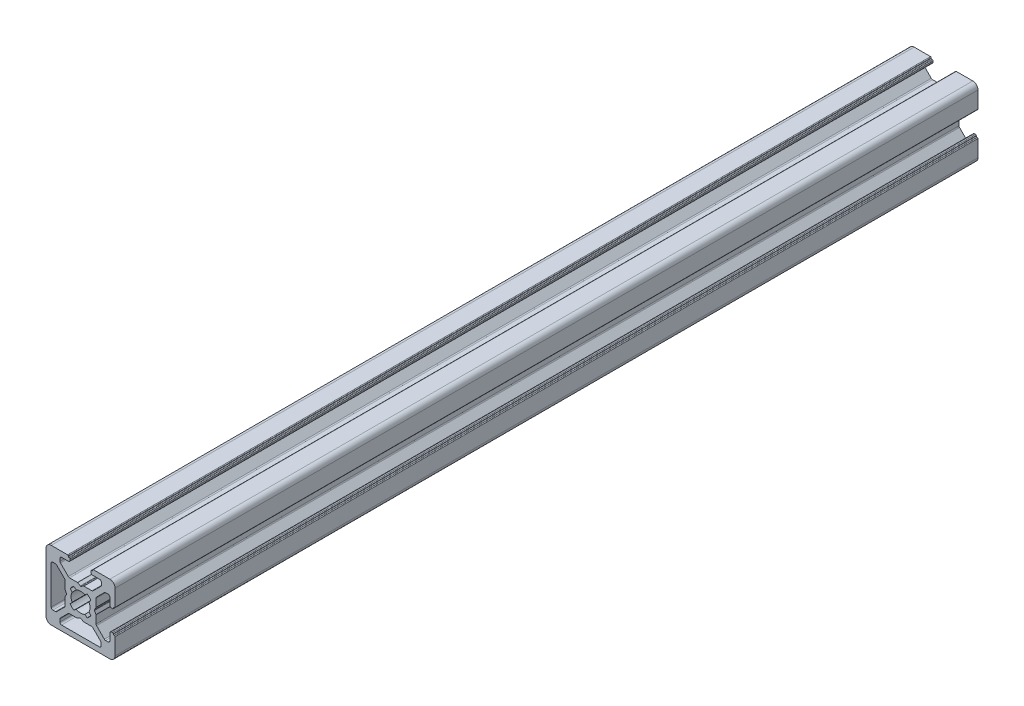
from build123d import *

# Parameters (mm, degrees)
EXTRUDE1_DEPTH = 250


with BuildPart() as part:
    # Sketch1 → Extrude1 (new body)
    with BuildSketch(Plane.XY):
        with BuildLine():
            Line((-8.5, -10), (8.5, -10))
            ThreePointArc((8.5, -10), (9.560660172, -9.560660172), (10, -8.5))
            Line((10, -8.5), (10, -3.7))
            ThreePointArc((10, -3.7), (9.941421356, -3.558578644), (9.8, -3.5))
            Line((9.8, -3.5), (9.7, -3.5))
            ThreePointArc((9.7, -3.5), (9.558578644, -3.441421356), (9.5, -3.3))
            Line((9.5, -3.3), (9.5, -3.2))
            ThreePointArc((9.5, -3.2), (9.441421356, -3.058578644), (9.3, -3))
            Line((9.3, -3), (9, -3))
            ThreePointArc((9, -3), (8.646446609, -3.146446609), (8.5, -3.5))
            Line((8.5, -3.5), (8.5, -5.500000208))
            ThreePointArc((8.5, -5.500000208), (8.353553391, -5.853553598), (8, -6.000000208))
            Line((8, -6.000000208), (7.267767022, -6.000000208))
            ThreePointArc((7.267767022, -6.000000208), (7.076425294, -5.961939969), (6.914213614, -5.853553581))
            Line((6.914213614, -5.853553581), (4.646446828, -3.585786575))
            ThreePointArc((4.646446828, -3.585786575), (4.538060465, -3.423574906), (4.500000236, -3.232233201))
            Line((4.500000236, -3.232233201), (4.500000236, -0.953589838))
            ThreePointArc((4.500000236, -0.953589838), (4.493185401, -0.901826029), (4.473205317, -0.853589838))
            Line((4.473205317, -0.853589838), (4.038120021, -0.1))
            ThreePointArc((4.038120021, -0.1), (4.011325101, 0), (4.038120021, 0.1))
            Line((4.038120021, 0.1), (4.473205317, 0.853589838))
            ThreePointArc((4.473205317, 0.853589838), (4.493185401, 0.901826029), (4.500000236, 0.953589838))
            Line((4.500000236, 0.953589838), (4.500000236, 3.232233262))
            ThreePointArc((4.500000236, 3.232233262), (4.538060467, 3.423574973), (4.646446837, 3.585786644))
            Line((4.646446837, 3.585786644), (6.914213678, 5.853553596))
            ThreePointArc((6.914213678, 5.853553596), (7.076425355, 5.961939978), (7.267767077, 6.000000214))
            Line((7.267767077, 6.000000214), (8.000000112, 6.000000214))
            ThreePointArc((8.000000112, 6.000000214), (8.353553502, 5.853553604), (8.500000112, 5.500000214))
            Line((8.500000112, 5.500000214), (8.500000112, 3.5))
            ThreePointArc((8.500000112, 3.5), (8.646446721, 3.146446609), (9.000000112, 3))
            Line((9.000000112, 3), (9.300000112, 3))
            ThreePointArc((9.300000112, 3), (9.441421468, 3.058578644), (9.500000112, 3.2))
            Line((9.500000112, 3.2), (9.500000112, 3.3))
            ThreePointArc((9.500000112, 3.3), (9.558578756, 3.441421356), (9.700000112, 3.5))
            Line((9.700000112, 3.5), (9.8, 3.5))
            ThreePointArc((9.8, 3.5), (9.941421356, 3.558578644), (10, 3.7))
            Line((10, 3.7), (10, 8.5))
            ThreePointArc((10, 8.5), (9.560660172, 9.560660172), (8.5, 10))
            Line((8.5, 10), (3.7, 10))
            ThreePointArc((3.7, 10), (3.558578644, 9.941421356), (3.5, 9.8))
            Line((3.5, 9.8), (3.5, 9.7))
            ThreePointArc((3.5, 9.7), (3.441421356, 9.558578644), (3.3, 9.5))
            Line((3.3, 9.5), (3.2, 9.5))
            ThreePointArc((3.2, 9.5), (3.058578644, 9.441421356), (3, 9.3))
            Line((3, 9.3), (3, 9.000000069))
            ThreePointArc((3, 9.000000069), (3.146446609, 8.646446678), (3.5, 8.500000069))
            Line((3.5, 8.500000069), (5.550000287, 8.500000069))
            ThreePointArc((5.550000287, 8.500000069), (5.903553677, 8.353553459), (6.050000287, 8.000000069))
            Line((6.050000287, 8.000000069), (6.050000287, 7.267766898))
            ThreePointArc((6.050000287, 7.267766898), (6.011940051, 7.076425176), (5.903553669, 6.914213499))
            Line((5.903553669, 6.914213499), (3.635786717, 4.646446658))
            ThreePointArc((3.635786717, 4.646446658), (3.473575046, 4.538060288), (3.282233335, 4.500000057))
            Line((3.282233335, 4.500000057), (1.003589985, 4.500000057))
            ThreePointArc((1.003589985, 4.500000057), (0.951826176, 4.493185222), (0.903589985, 4.473205138))
            Line((0.903589985, 4.473205138), (0.150000146, 4.038119841))
            ThreePointArc((0.150000146, 4.038119841), (0.050000146, 4.011324922), (-0.049999854, 4.038119841))
            Line((-0.049999854, 4.038119841), (-0.803589692, 4.473205138))
            ThreePointArc((-0.803589692, 4.473205138), (-0.851825883, 4.493185222), (-0.903589692, 4.500000057))
            Line((-0.903589692, 4.500000057), (-3.182233104, 4.500000057))
            ThreePointArc((-3.182233104, 4.500000057), (-3.37357482, 4.538060291), (-3.535786494, 4.646446666))
            Line((-3.535786494, 4.646446666), (-5.803553391, 6.914213562))
            ThreePointArc((-5.803553391, 6.914213562), (-5.911939766, 7.076425237), (-5.95, 7.267766953))
            Line((-5.95, 7.267766953), (-5.95, 8))
            ThreePointArc((-5.95, 8), (-5.803553391, 8.353553391), (-5.45, 8.5))
            Line((-5.45, 8.5), (-3.5, 8.5))
            ThreePointArc((-3.5, 8.5), (-3.146446609, 8.646446609), (-3, 9))
            Line((-3, 9), (-3, 9.3))
            ThreePointArc((-3, 9.3), (-3.058578644, 9.441421356), (-3.2, 9.5))
            Line((-3.2, 9.5), (-3.35, 9.5))
            ThreePointArc((-3.35, 9.5), (-3.491421356, 9.558578644), (-3.55, 9.7))
            Line((-3.55, 9.7), (-3.55, 9.8))
            ThreePointArc((-3.55, 9.8), (-3.608578644, 9.941421356), (-3.75, 10))
            Line((-3.75, 10), (-8.5, 10))
            ThreePointArc((-8.5, 10), (-9.560660172, 9.560660172), (-10, 8.5))
            Line((-10, 8.5), (-10, -8.5))
            ThreePointArc((-10, -8.5), (-9.560660172, -9.560660172), (-8.5, -10))
        make_face()
        with BuildLine():
            Line((-5.500000147, -8.500000123), (5.500000242, -8.500000123))
            ThreePointArc((5.500000242, -8.500000123), (5.853553633, -8.353553514), (6.000000242, -8.000000123))
            Line((6.000000242, -8.000000123), (6.000000242, -7.267766878))
            ThreePointArc((6.000000242, -7.267766878), (5.961940006, -7.076425156), (5.853553624, -6.914213479))
            Line((5.853553624, -6.914213479), (3.585786637, -4.646446602))
            ThreePointArc((3.585786637, -4.646446602), (3.423574966, -4.538060233), (3.232233255, -4.500000001))
            Line((3.232233255, -4.500000001), (0.953589836, -4.500000001))
            ThreePointArc((0.953589836, -4.500000001), (0.901826025, -4.493185166), (0.853589832, -4.47320508))
            Line((0.853589832, -4.47320508), (0.100000004, -4.038119765))
            ThreePointArc((0.100000004, -4.038119765), (5e-09, -4.011324843), (-0.099999996, -4.03811976))
            Line((-0.099999996, -4.03811976), (-0.853589845, -4.473205038))
            ThreePointArc((-0.853589845, -4.473205038), (-0.901826034, -4.493185121), (-0.953589841, -4.499999955))
            Line((-0.953589841, -4.499999955), (-3.232233196, -4.499999955))
            ThreePointArc((-3.232233196, -4.499999955), (-3.423574907, -4.538060186), (-3.585786578, -4.646446556))
            Line((-3.585786578, -4.646446556), (-5.853553529, -6.914213397))
            ThreePointArc((-5.853553529, -6.914213397), (-5.961939911, -7.076425074), (-6.000000147, -7.267766796))
            Line((-6.000000147, -7.267766796), (-6.000000147, -8.000000123))
            ThreePointArc((-6.000000147, -8.000000123), (-5.853553538, -8.353553514), (-5.500000147, -8.500000123))
        make_face(mode=Mode.SUBTRACT)
        with BuildLine():
            Line((1.258185317, -2.445295423), (1.913894874, -2.989641056))
            ThreePointArc((1.913894874, -2.989641056), (2.510074363, -2.510074485), (2.989640962, -1.91389502))
            Line((2.989640962, -1.91389502), (2.445295362, -1.258185436))
            ThreePointArc((2.445295362, -1.258185436), (2.75, -6.7e-08), (2.445295423, 1.258185317))
            Line((2.445295423, 1.258185317), (2.989641056, 1.913894874))
            ThreePointArc((2.989641056, 1.913894874), (2.510074485, 2.510074363), (1.91389502, 2.989640962))
            Line((1.91389502, 2.989640962), (1.258185436, 2.445295362))
            ThreePointArc((1.258185436, 2.445295362), (6.7e-08, 2.75), (-1.258185317, 2.445295423))
            Line((-1.258185317, 2.445295423), (-1.913894874, 2.989641056))
            ThreePointArc((-1.913894874, 2.989641056), (-2.510074363, 2.510074485), (-2.989640962, 1.91389502))
            Line((-2.989640962, 1.91389502), (-2.445295362, 1.258185436))
            ThreePointArc((-2.445295362, 1.258185436), (-2.75, 6.7e-08), (-2.445295423, -1.258185317))
            Line((-2.445295423, -1.258185317), (-2.992174953, -1.909930962))
            ThreePointArc((-2.992174953, -1.909930962), (-2.511737261, -2.508410485), (-1.91389502, -2.989640962))
            Line((-1.91389502, -2.989640962), (-1.258185436, -2.445295362))
            ThreePointArc((-1.258185436, -2.445295362), (-6.7e-08, -2.75), (1.258185317, -2.445295423))
        make_face(mode=Mode.SUBTRACT)
        with BuildLine():
            Line((-8.5, -5.5), (-8.5, 5.50000039))
            ThreePointArc((-8.5, 5.50000039), (-8.353553351, 5.853553875), (-7.999999866, 6.000000524))
            Line((-7.999999866, 6.000000524), (-7.267766819, 6.000000524))
            ThreePointArc((-7.267766819, 6.000000524), (-7.076425092, 5.961940285), (-6.914213411, 5.853553897))
            Line((-6.914213411, 5.853553897), (-4.646446626, 3.585786891))
            ThreePointArc((-4.646446626, 3.585786891), (-4.538060262, 3.423575222), (-4.500000033, 3.232233517))
            Line((-4.500000033, 3.232233517), (-4.500000033, 0.953590154))
            ThreePointArc((-4.500000033, 0.953590154), (-4.493185199, 0.901826345), (-4.473205114, 0.853590154))
            Line((-4.473205114, 0.853590154), (-4.038119781, 0.100000251))
            ThreePointArc((-4.038119781, 0.100000251), (-4.011324861, 2.51e-07), (-4.038119781, -0.099999749))
            Line((-4.038119781, -0.099999749), (-4.473205138, -0.853589692))
            ThreePointArc((-4.473205138, -0.853589692), (-4.493185222, -0.901825883), (-4.500000057, -0.953589692))
            Line((-4.500000057, -0.953589692), (-4.500000057, -3.232233104))
            ThreePointArc((-4.500000057, -3.232233104), (-4.538060291, -3.42357482), (-4.646446666, -3.585786494))
            Line((-4.646446666, -3.585786494), (-6.914213562, -5.853553391))
            ThreePointArc((-6.914213562, -5.853553391), (-7.076425237, -5.961939766), (-7.267766953, -6))
            Line((-7.267766953, -6), (-8, -6))
            ThreePointArc((-8, -6), (-8.353553391, -5.853553391), (-8.5, -5.5))
        make_face(mode=Mode.SUBTRACT)
    extrude(amount=EXTRUDE1_DEPTH)


solid = part.part
